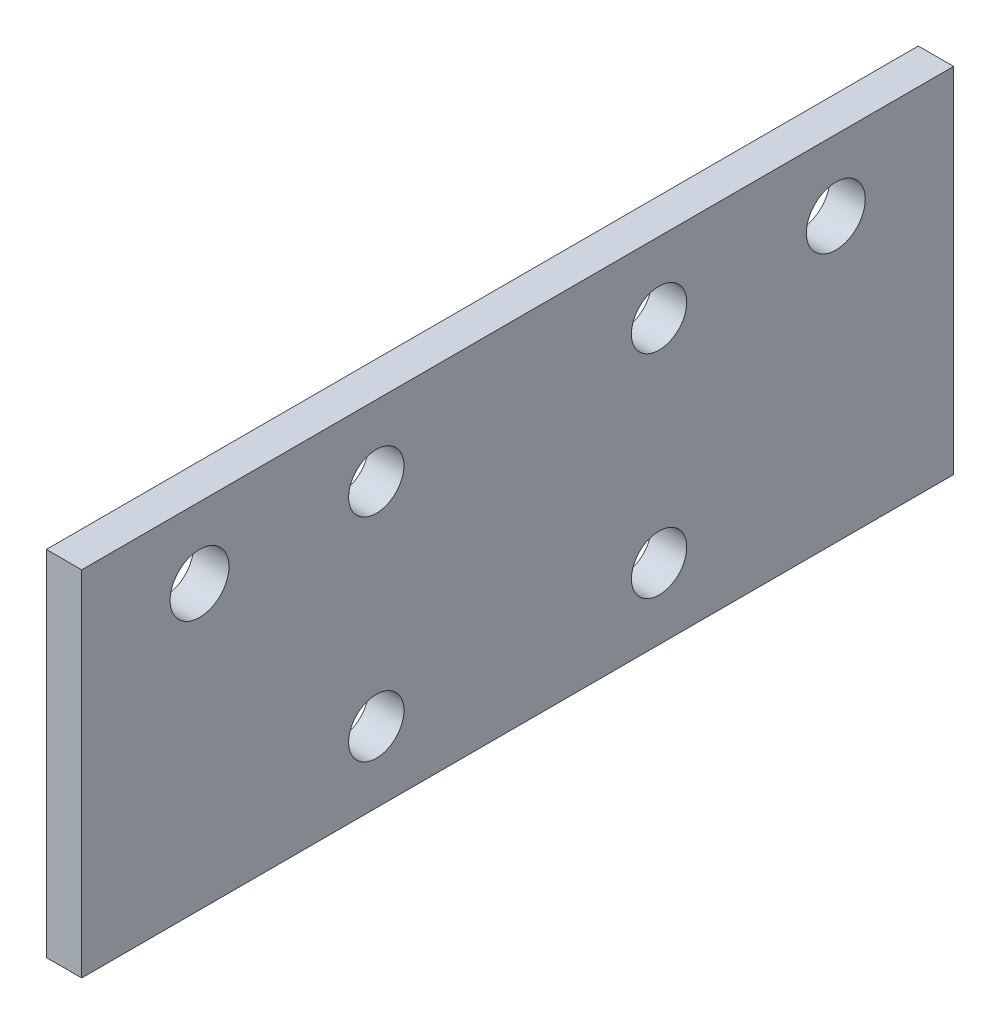
from build123d import *

# Parameters (mm, degrees)
SKETCH1_W           = 17
SKETCH1_H           = 30
SKETCH1_R           = 2.5
SKETCH1_W_2         = 40
SKETCH1_R_2         = 2.35
BOSS_EXTRUDE1_DEPTH = 3


with BuildPart() as part:
    # Sketch1 → Boss-Extrude1 (new body)
    # profile 1 of 3: a face of its own
    with BuildSketch(Plane(origin=(0, 0, 0), x_dir=(0, 0, -1), z_dir=(1, 0, 0))):
        with Locations((21.933683822, -2.188772059)):
            Rectangle(SKETCH1_W, SKETCH1_H)
        with Locations((20.433683822, 6.811227941)):
            Circle(SKETCH1_R, mode=Mode.SUBTRACT)
    # profile 2 of 3: a face of its own
    with BuildSketch(Plane(origin=(0, 0, 0), x_dir=(0, 0, -1), z_dir=(1, 0, 0))):
        with Locations((-6.566316178, -2.188772059)):
            Rectangle(SKETCH1_W_2, SKETCH1_H)
        with Locations((-18.566316178, 6.811227941)):
            Circle(SKETCH1_R_2, mode=Mode.SUBTRACT)
        with Locations((5.433683822, 6.811227941)):
            Circle(SKETCH1_R_2, mode=Mode.SUBTRACT)
        with Locations((5.433683822, -11.188772059)):
            Circle(SKETCH1_R_2, mode=Mode.SUBTRACT)
        with Locations((-18.566316178, -11.188772059)):
            Circle(SKETCH1_R_2, mode=Mode.SUBTRACT)
    # profile 3 of 3: a face of its own
    with BuildSketch(Plane(origin=(0, 0, 0), x_dir=(0, 0, -1), z_dir=(1, 0, 0))):
        with Locations((-35.066316178, -2.188772059)):
            Rectangle(SKETCH1_W, SKETCH1_H)
        with Locations((-33.566316178, 6.811227941)):
            Circle(SKETCH1_R, mode=Mode.SUBTRACT)
    extrude(amount=BOSS_EXTRUDE1_DEPTH)


solid = part.part
